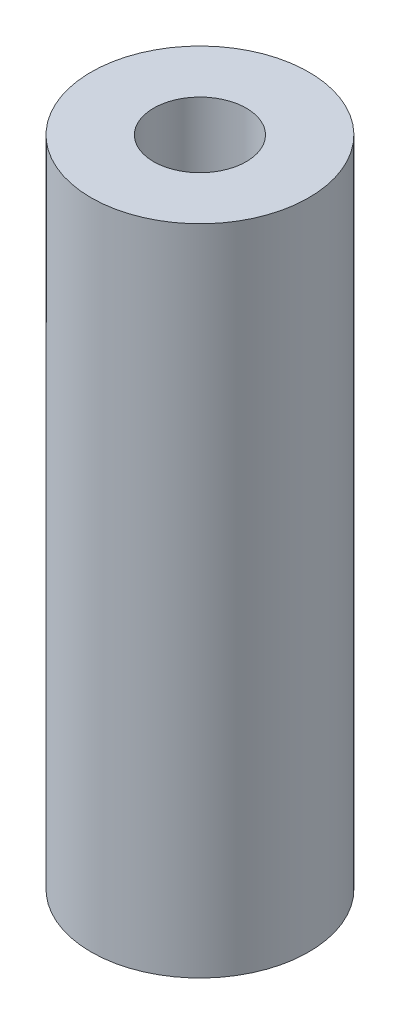
from build123d import *

# Parameters (mm, degrees)
SKETCH1_R                 = 3.175
BOSS_EXTRUDE1_DEPTH       = 19.05
TAP_DRILL_FOR_6_32_TAP1_D = 2.7051


with BuildPart() as part:
    # Sketch1 → Boss-Extrude1 (new body)
    with BuildSketch(Plane(origin=(0, 0, 0), x_dir=(1, 0, 0), z_dir=(0, 1, 0))):
        with Locations(Location((0, 0, 0), (0, 0, 90))):
            Circle(SKETCH1_R)
    extrude(amount=BOSS_EXTRUDE1_DEPTH)

    # Tap Drill for #6-32 Tap1 (through all)
    with Locations(Plane(origin=(0, 19.05, 0), x_dir=(1, 0, 0), z_dir=(0, 1, 0))):
        with Locations((0, 0)):
            Hole(TAP_DRILL_FOR_6_32_TAP1_D / 2)


solid = part.part
